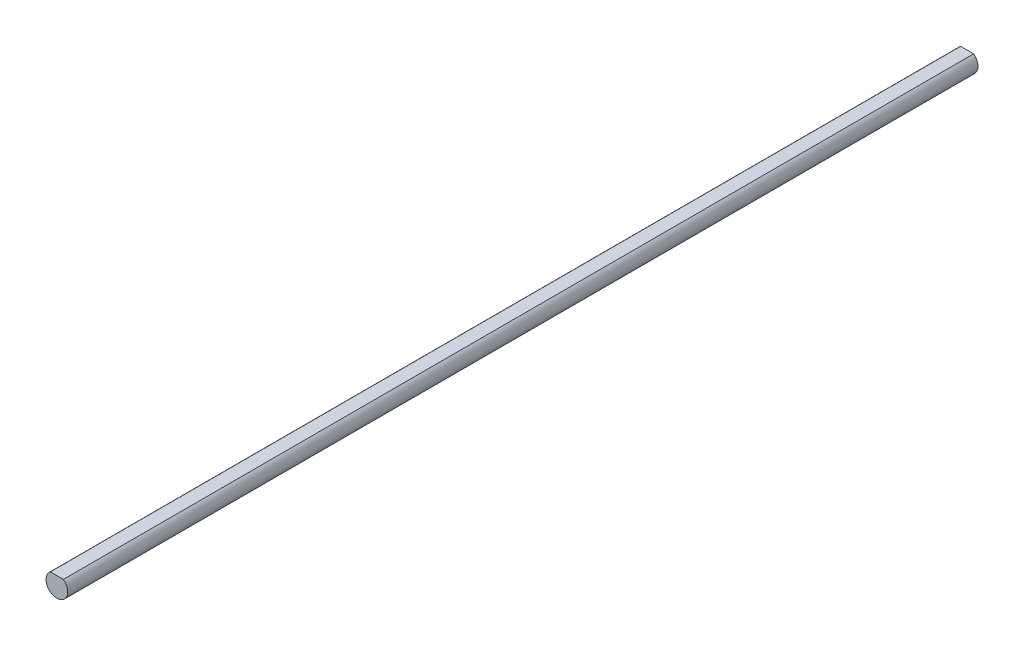
from build123d import *

# Parameters (mm, degrees)
SKETCH2_R           = 3.175
BOSS_EXTRUDE1_DEPTH = 265.8872
SKETCH3_W           = 6.865908088
SKETCH3_H           = 0.635
CUT_EXTRUDE1_DEPTH  = 265.8872


with BuildPart() as part:
    # Sketch2 → Boss-Extrude1 (new body)
    with BuildSketch(Plane.XY):
        Circle(SKETCH2_R)
    extrude(amount=BOSS_EXTRUDE1_DEPTH)

    # Sketch3 → Cut-Extrude1 (cut)
    with BuildSketch(Plane.XY.offset(265.8872)):
        with Locations((0.030816464, 2.8575)):
            Rectangle(SKETCH3_W, SKETCH3_H)
    extrude(amount=-CUT_EXTRUDE1_DEPTH, mode=Mode.SUBTRACT)


solid = part.part
